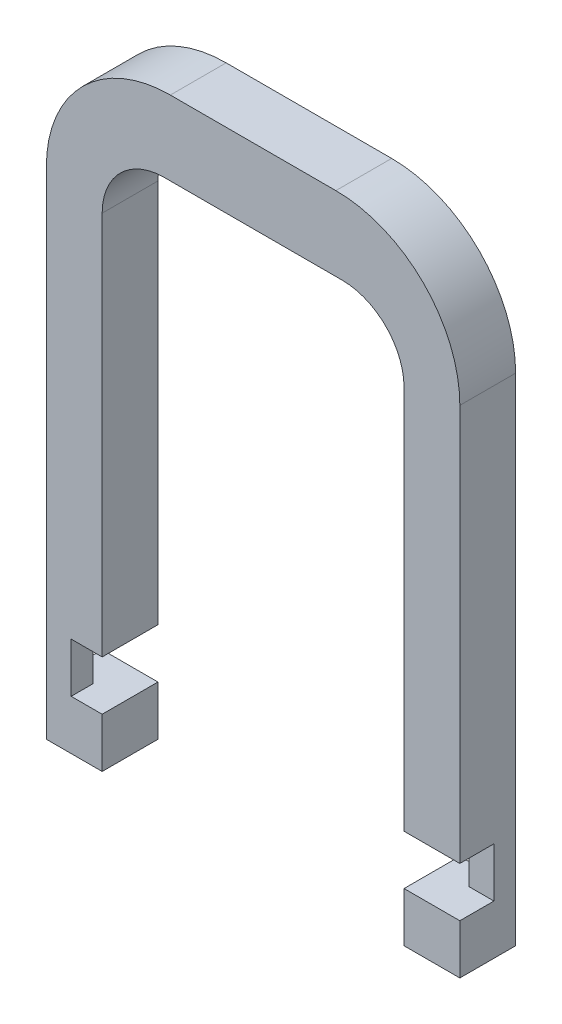
from build123d import *

# Parameters (mm, degrees)
SKETCH1_W             = 4.5
SKETCH1_H             = 4.5
BOSS_EXTRUDE1_DEPTH   = 50
BOSS_EXTRUDE1_2_DEPTH = 50
SKETCH2_W             = 4.5
SKETCH2_H             = 6
BOSS_EXTRUDE2_DEPTH   = 25
FILLET1_R             = 10
FILLET2_R             = 5
SKETCH5_W             = 4.5
SKETCH5_H             = 4
CUT_EXTRUDE3_DEPTH    = 2.75
SKETCH6_W             = 4.5
SKETCH6_H             = 4
CUT_EXTRUDE4_DEPTH    = 2.75
SKETCH3_W             = 4.5
SKETCH3_H             = 4
CUT_EXTRUDE1_DEPTH    = 2.5
SKETCH4_W             = 4.5
SKETCH4_H             = 4
CUT_EXTRUDE2_DEPTH    = 2.5


with BuildPart() as part:
    # Sketch1 → Boss-Extrude1 (new body)
    with BuildSketch(Plane(origin=(0, 0, 0), x_dir=(1, 0, 0), z_dir=(0, 1, 0))):
        with Locations((-18.391025641, 0.25)):
            Rectangle(SKETCH1_W, SKETCH1_H)
    extrude(amount=BOSS_EXTRUDE1_DEPTH)



with BuildPart() as body_2:
    # Sketch1 → Boss-Extrude1 2 (new body)
    with BuildSketch(Plane(origin=(0, 0, 0), x_dir=(1, 0, 0), z_dir=(0, 1, 0))):
        with Locations((10.458974359, 0.25)):
            Rectangle(SKETCH1_W, SKETCH1_H)
    extrude(amount=BOSS_EXTRUDE1_2_DEPTH)


with BuildPart() as part_1:
    add(part.part)

    add(body_2.part)  # Boss-Extrude2 merges body 2
    # Sketch2 → Boss-Extrude2 (add)
    with BuildSketch(Plane.ZY.offset(-8.208974359)):
        with Locations((-0.25, 47)):
            Rectangle(SKETCH2_W, SKETCH2_H)
    extrude(amount=BOSS_EXTRUDE2_DEPTH)

    # Fillet1
    fillet1_edges = [part_1.edges().sort_by_distance(p)[0] for p in [
        (-20.641025641, 50, -0.25),
        (12.708974359, 50, -0.25),
    ]]
    fillet(fillet1_edges, radius=FILLET1_R)

    # Fillet2
    fillet2_edges = [part_1.edges().sort_by_distance(p)[0] for p in [
        (-16.141025641, 44, -0.25),
        (8.208974359, 44, -0.25),
    ]]
    fillet(fillet2_edges, radius=FILLET2_R)

    # Sketch5 → Cut-Extrude3 (cut)
    with BuildSketch(Plane.XY.offset(2)):
        with Locations((10.458974359, 6)):
            Rectangle(SKETCH5_W, SKETCH5_H)
    extrude(amount=-CUT_EXTRUDE3_DEPTH, mode=Mode.SUBTRACT)

    # Sketch6 → Cut-Extrude4 (cut)
    with BuildSketch(Plane(origin=(0, 0, -2.5), x_dir=(-1, 0, 0), z_dir=(0, 0, -1))):
        with Locations((18.391025641, 6)):
            Rectangle(SKETCH6_W, SKETCH6_H)
    extrude(amount=-CUT_EXTRUDE4_DEPTH, mode=Mode.SUBTRACT)

    # Sketch3 → Cut-Extrude1 (cut)
    with BuildSketch(Plane.ZY.offset(-8.208974359)):
        with Locations((-0.25, 6)):
            Rectangle(SKETCH3_W, SKETCH3_H)
    extrude(amount=-CUT_EXTRUDE1_DEPTH, mode=Mode.SUBTRACT)

    # Sketch4 → Cut-Extrude2 (cut)
    with BuildSketch(Plane(origin=(-16.141025641, 0, 0), x_dir=(0, 0, -1), z_dir=(1, 0, 0))):
        with Locations((0.25, 6)):
            Rectangle(SKETCH4_W, SKETCH4_H)
    extrude(amount=-CUT_EXTRUDE2_DEPTH, mode=Mode.SUBTRACT)


solid = part_1.part
